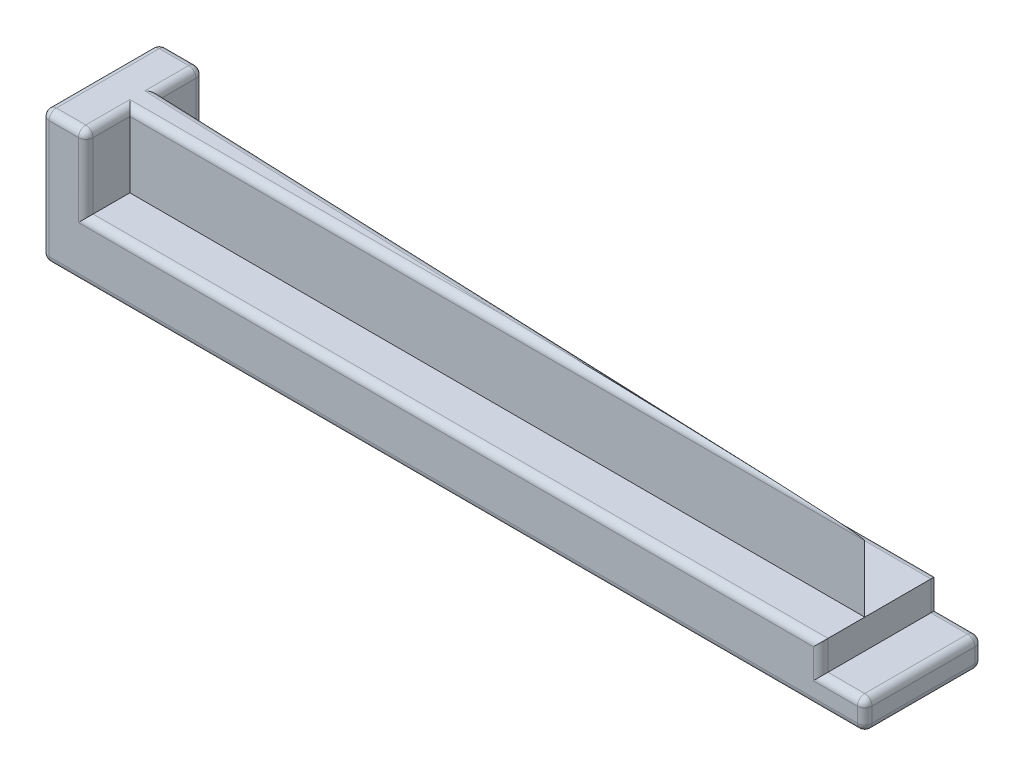
from build123d import *

# Parameters (mm, degrees)
BOSS_EXTRUDE1_DEPTH = 5
SKETCH2_W           = 56
SKETCH2_H           = 8
BOSS_EXTRUDE2_DEPTH = 4
SKETCH3_3_W         = 3
SKETCH3_3_H         = 8
CUT_EXTRUDE2_DEPTH  = 2
SKETCH3_W           = 3
SKETCH3_H           = 8
BOSS_EXTRUDE4_DEPTH = 5
FILLET1_R           = 0.5


with BuildPart() as part:
    # Sketch1 → Boss-Extrude1 (new body)
    with BuildSketch(Plane(origin=(0, 0, 0), x_dir=(1, 0, 0), z_dir=(0, 1, 0))):
        Polygon((0, 0), (50, 0), (0, 2), align=None)
    extrude(amount=BOSS_EXTRUDE1_DEPTH)

    # Sketch2 → Boss-Extrude2 (add)
    with BuildSketch(Plane.XZ):
        with Locations((25, -1)):
            Rectangle(SKETCH2_W, SKETCH2_H)
    extrude(amount=BOSS_EXTRUDE2_DEPTH)

    # Sketch3<3> → Cut-Extrude2 (cut)
    with BuildSketch(Plane(origin=(0, 0, 0), x_dir=(1, 0, 0), z_dir=(0, 1, 0))):
        with Locations((51.5, 1)):
            Rectangle(SKETCH3_3_W, SKETCH3_3_H)
    extrude(amount=-CUT_EXTRUDE2_DEPTH, mode=Mode.SUBTRACT)

    # Sketch3 → Boss-Extrude4 (add)
    with BuildSketch(Plane(origin=(0, 0, 0), x_dir=(1, 0, 0), z_dir=(0, 1, 0))):
        with Locations((-1.5, 1)):
            Rectangle(SKETCH3_W, SKETCH3_H)
        with Locations((51.5, 1)):
            Rectangle(SKETCH3_W, SKETCH3_H)
    extrude(amount=BOSS_EXTRUDE4_DEPTH)


with BuildPart() as boss_extrude4_kept_piece:
    # of the separate pieces the step leaves, the one the design keeps (boss_extrude4_pieces_kept)
    add(part.part.solids().sort_by_distance((0, 0, 3))[0])

    # Fillet1
    fillet1_edges = [boss_extrude4_kept_piece.edges().sort_by_distance(p)[0] for p in [
        (-3, 0.5, 3),
        (25, 5, -1),
        (-3, 0.5, -5),
        (53, -3, -5),
        (53, -3, 3),
        (-3, -4, -1),
        (25, -4, -5),
        (53, -4, -1),
        (25, -4, 3),
        (25, 0, 3),
        (51.5, -2, -5),
        (50, -1, -5),
        (53, -2, -1),
        (51.5, -2, 3),
        (50, -1, 3),
        (25, 0, -5),
        (0, 5, 1.5),
        (0, 2.5, 3),
        (0, 5, -3.5),
        (0, 2.5, -5),
        (-1.5, 5, -5),
        (-3, 5, -1),
        (-1.5, 5, 3),
        (25, 5, 0),
    ]]
    fillet(fillet1_edges, radius=FILLET1_R)


solid = boss_extrude4_kept_piece.part
